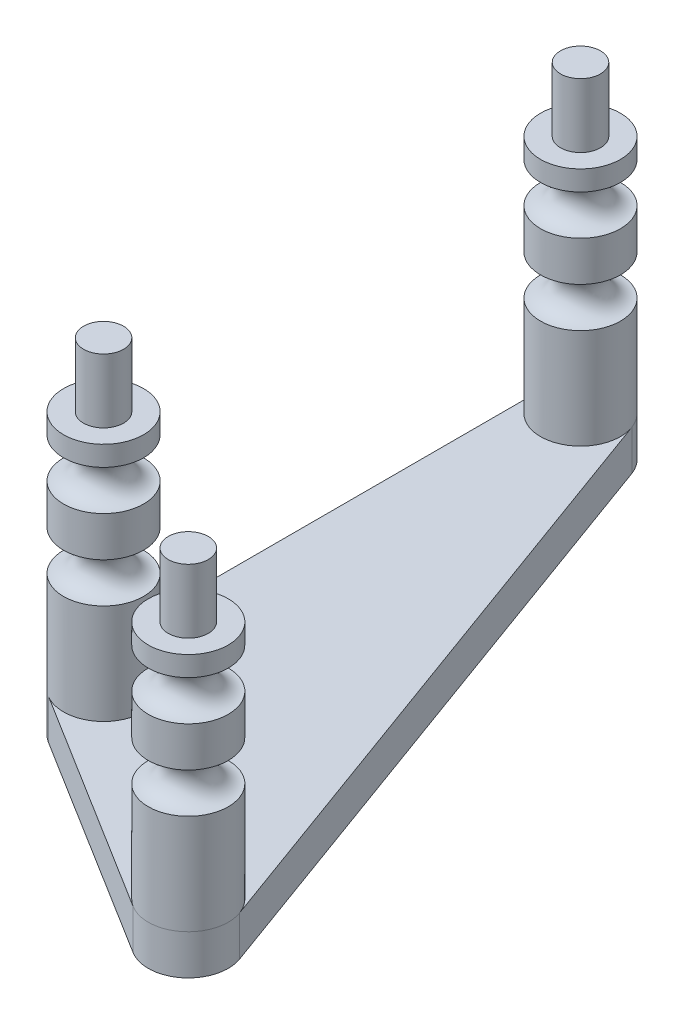
from build123d import *

# Parameters (mm, degrees)
SKETCH1_R           = 6.350000000000003
SKETCH1_R_2         = 6.349999999999998
SKETCH1_R_3         = 6.35
BOSS_EXTRUDE1_DEPTH = 6.35
SKETCH1_4_R         = 6.349999999999998
SKETCH1_4_R_2       = 6.35
SKETCH1_4_R_3       = 6.350000000000003
BOSS_EXTRUDE2_DEPTH = 44.449999999999996
FILLET1_R           = 6.35
SKETCH3_R           = 3.175
SKETCH3_R_2         = 3.174999999999998
SKETCH3_R_3         = 3.174999999999999
BOSS_EXTRUDE3_DEPTH = 10.16
SKETCH4_R           = 3.175000000000005
SKETCH4_R_2         = 3.1750000000000016
SKETCH5_R           = 3.1749999999999976
SKETCH5_R_2         = 3.1750000000000016
SKETCH6_R           = 3.174999999999997
SKETCH6_R_2         = 3.1750000000000003


with BuildPart() as part:
    # Sketch1 → Boss-Extrude1 (new body)
    with BuildSketch(Plane(origin=(0, 0, 0), x_dir=(1, 0, 0), z_dir=(0, 1, 0))):
        with BuildLine():
            Line((30.226765369732554, -18.817809436848275), (5.390705765753413, -3.356008245978078))
            ThreePointArc((5.390705765753469, -3.3560082459779954), (1.4387483457917447, -6.184860806637569), (-3.3560083646981127, -5.3907056918437215))
            Line((-3.3560083646981127, -5.390705691843724), (32.26146256663769, -27.56452324757546))
            ThreePointArc((32.26146256663769, -27.56452324757546), (29.432610301605155, -23.612565911505385), (30.226765369732504, -18.817809436848364))
        make_face()
        with BuildLine():
            ThreePointArc((41.96747113548598, -22.173817682826357), (38.700638791307945, -27.725085754726088), (32.26146256663769, -27.56452324757546))
            Line((32.26146256663769, -27.56452324757546), (47.87493319782594, -37.284759977891774))
            Line((47.874933197825946, -37.28475997789178), (41.58451928792457, -20.001989801414197))
            ThreePointArc((41.58451928792457, -20.001989801414197), (41.87100036976582, -21.071151769683357), (41.96747113548598, -22.173817682826357))
        make_face()
        with BuildLine():
            ThreePointArc((6.349999999999998, 75.68437999999999), (5.2016154812350885, 72.04216962917084), (2.1718279101179707, 69.71733185800946))
            Line((2.1718279101179623, 69.71733185800946), (33.445643225368016, -16.206769540835808))
            ThreePointArc((33.445643225368, -16.20676954083583), (38.301097111382425, -16.41876324159873), (41.58451928792457, -20.001989801414197))
            Line((41.58451928792457, -20.001989801414197), (5.967048123074589, 77.85620796208907))
            ThreePointArc((5.967048123074587, 77.85620796208907), (6.253529226825584, 76.78704595541812), (6.349999999999998, 75.68437999999999))
        make_face()
        with BuildLine():
            ThreePointArc((-6.35, 7.8e-16), (-4.490128060534566, 4.490128060534587), (2.859e-14, 6.35))
            Line((0, 6.35), (0, 69.33438))
            ThreePointArc((2.703e-14, 69.33438), (-4.490128060534566, 71.1942519394654), (-6.349999999999998, 75.68437999999999))
            Line((-6.3500000000000005, 75.68437999999999), (-6.35, -2.22e-15))
        make_face()
        with BuildLine():
            Line((-6.350000000000001, 111.69701955457307), (-6.3500000000000005, 75.68437999999999))
            ThreePointArc((-6.349999999999998, 75.68437999999999), (-1.1026659554181295, 81.93790922682558), (5.967048123074587, 77.85620796208907))
            Line((5.967048123074589, 77.85620796208907), (-6.350000000000001, 111.69701955457307))
        make_face()
        with Locations((35.61747113548598, -22.173817682826357)):
            Circle(SKETCH1_R)
        with Locations((0, 75.68437999999999)):
            Circle(SKETCH1_R_2)
        Circle(SKETCH1_R_3)
        Polygon((0, 75.68437999999999), (35.61747113548598, -22.173817682826357), (0, 0), align=None)
    extrude(amount=BOSS_EXTRUDE1_DEPTH)

    # Sketch1<4> → Boss-Extrude2 (add)
    with BuildSketch(Plane(origin=(0, 0, 0), x_dir=(1, 0, 0), z_dir=(0, 1, 0))):
        with Locations(Location((0, 75.68437999999999, 0), (0, 0, 20))):
            Circle(SKETCH1_4_R)
        with Locations(Location((0, 0, 0), (0, 0, 180))):
            Circle(SKETCH1_4_R_2)
        with Locations(Location((35.61747113548598, -22.173817682826357, 0), (0, 0, 20))):
            Circle(SKETCH1_4_R_3)
    extrude(amount=BOSS_EXTRUDE2_DEPTH)

    # Fillet1
    fillet1_edges = [part.edges().sort_by_distance(p)[0] for p in [
        (47.87493319782594, 3.175, 37.28475997789178),
        (-6.350000000000001, 3.175, -111.69701955457307),
    ]]
    fillet(fillet1_edges, radius=FILLET1_R)

    # Sketch3 → Boss-Extrude3 (add)
    with BuildSketch(Plane(origin=(0, 44.449999999999996, 0), x_dir=(1, 0, 0), z_dir=(0, 1, 0))):
        with Locations(Location((0, 0, 0), (0, 0, 270))):
            Circle(SKETCH3_R)
        with Locations(Location((35.61747113548598, -22.173817682826357, 0), (0, 0, 270))):
            Circle(SKETCH3_R_2)
        with Locations(Location((0, 75.68437999999999, 0), (0, 0, 270))):
            Circle(SKETCH3_R_3)
    extrude(amount=BOSS_EXTRUDE3_DEPTH)

    # Sketch4 → Cut-Revolve1 (revolve, cut)
    with BuildSketch(Plane(origin=(35.61747113548597, 0, 22.173817682826357), x_dir=(0, 1, 0), z_dir=(0.8489300418509319, 0, 0.5285052355870989)), mode=Mode.PRIVATE) as cut_revolve1_sk:
        with Locations((38.099999999999994, 6.349999999999994)):
            Circle(SKETCH4_R)
        with Locations((25.399999999999995, 6.349999999999994)):
            Circle(SKETCH4_R_2)
    revolve(cut_revolve1_sk.sketch.rotate(Axis((35.61747113548598, 6.350000000000001, 22.173817682826357), (0, 1, 0)), 211.904515146), axis=Axis((35.61747113548598, 6.350000000000001, 22.173817682826357), (0, 1, 0)), mode=Mode.SUBTRACT)

    # Sketch5 → Cut-Revolve2 (revolve, cut)
    with BuildSketch(Plane(origin=(0, 0, 0), x_dir=(0, -1, 0), z_dir=(-0.8489300418509319, 0, -0.5285052355870989)), mode=Mode.PRIVATE) as cut_revolve2_sk:
        with Locations((-38.099999999999994, 6.349999999999999)):
            Circle(SKETCH5_R)
        with Locations((-25.399999999999995, 6.349999999999999)):
            Circle(SKETCH5_R_2)
    revolve(cut_revolve2_sk.sketch.rotate(Axis((0, 6.349999999999998, 0), (0, -1, 0)), 328.095484854), axis=Axis((0, 6.349999999999998, 0), (0, -1, 0)), mode=Mode.SUBTRACT)

    # Sketch6 → Cut-Revolve3 (revolve, cut)
    with BuildSketch(Plane(origin=(-24.32449085540351, 0, -66.83098936495286), x_dir=(0, 1, 0), z_dir=(-0.3420201433256631, 0, -0.9396926207859105)), mode=Mode.PRIVATE) as cut_revolve3_sk:
        with Locations((38.099999999999994, 32.23558249511394)):
            Circle(SKETCH6_R)
        with Locations((25.399999999999995, 32.23558249511394)):
            Circle(SKETCH6_R_2)
    revolve(cut_revolve3_sk.sketch.rotate(Axis((0, 6.350000000000001, -75.68437999999999), (0, 1, 0)), 70), axis=Axis((0, 6.350000000000001, -75.68437999999999), (0, 1, 0)), mode=Mode.SUBTRACT)


solid = part.part
